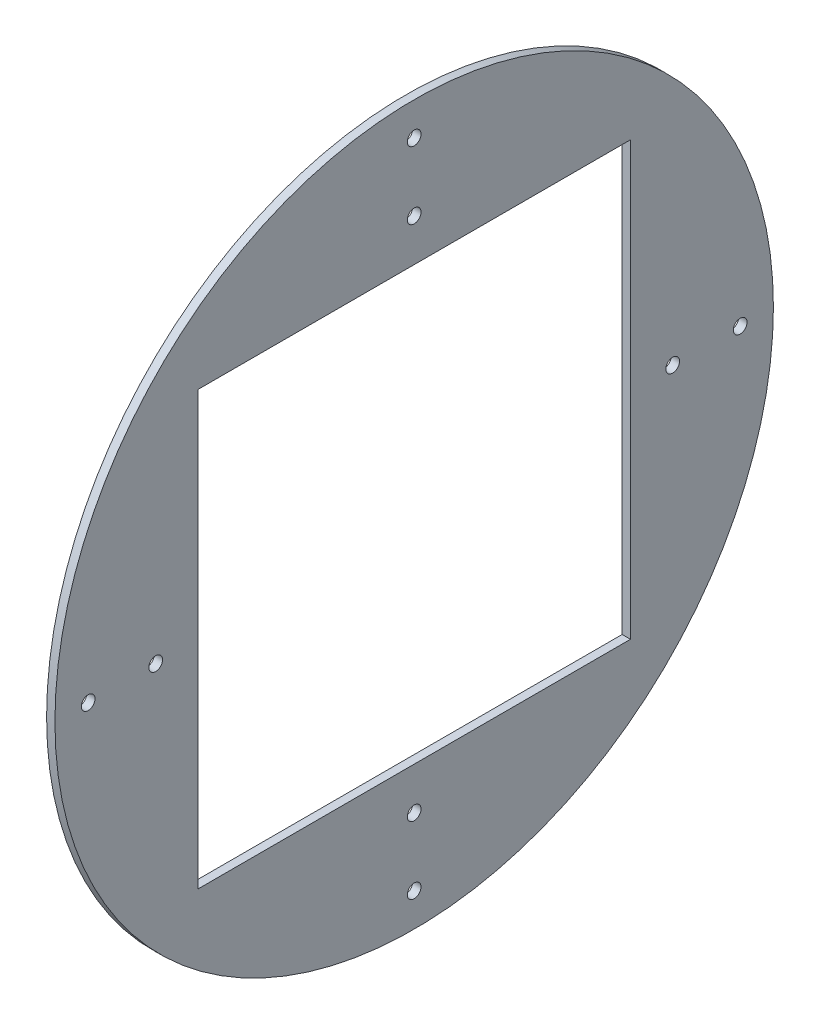
from build123d import *

# Parameters (mm, degrees)
SKETCH1_R           = 86.487
BOSS_EXTRUDE1_DEPTH = 2.0066
SKETCH6_W           = 104.14
SKETCH6_H           = 104.14
CUT_EXTRUDE2_DEPTH  = 123.327547108
SKETCH7_R           = 1.651
CUT_EXTRUDE3_DEPTH  = 123.327547108
CIRPATTERN1_COUNT   = 4


with BuildPart() as part:
    # Sketch1 → Boss-Extrude1 (new body)
    with BuildSketch(Plane.YZ):
        with Locations(Location((0, 0, 0), (0, 0, 270))):
            Circle(SKETCH1_R)
    extrude(amount=BOSS_EXTRUDE1_DEPTH)

    # Sketch6 → Cut-Extrude2 (cut, through all)
    with BuildSketch(Plane(origin=(2.0066, 0, 0), x_dir=(0, 0, -1), z_dir=(1, 0, 0))):
        Rectangle(SKETCH6_W, SKETCH6_H)
    extrude(amount=-CUT_EXTRUDE2_DEPTH, mode=Mode.SUBTRACT)

    # Sketch7 → Cut-Extrude3 (cut, through all)
    with BuildSketch(Plane.YZ.offset(2.0066)):
        with Locations(Location((62.23, 0, 0), (0, 0, 270))):
            Circle(SKETCH7_R)
        with Locations(Location((78.486, 0, 0), (0, 0, 270))):
            Circle(SKETCH7_R)
    cut_extrude3 = extrude(amount=-CUT_EXTRUDE3_DEPTH, mode=Mode.SUBTRACT)

    # CirPattern1: Cut-Extrude3 ×4 about axis
    cirpattern1_axis = Axis((0, 0, 0), (1, 0, 0))
    for i in range(1, CIRPATTERN1_COUNT):
        add(cut_extrude3.rotate(cirpattern1_axis, i * 360 / CIRPATTERN1_COUNT), mode=Mode.SUBTRACT)


solid = part.part
